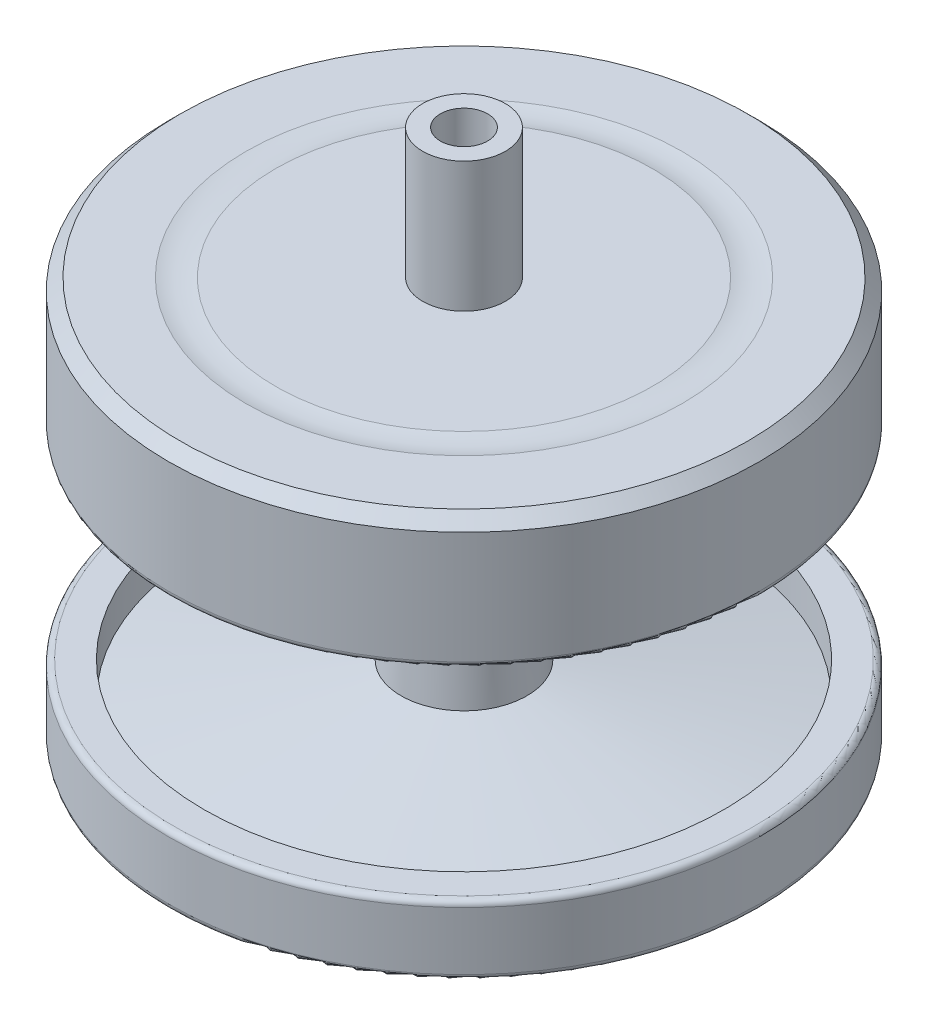
from build123d import *

# Parameters (mm, degrees)
FILLET_1_R = 0.5


with BuildPart() as part:
    # 草图1 → 旋转1 (revolve)
    with BuildSketch(Plane.XY, mode=Mode.PRIVATE) as revolve_1_sk:
        with BuildLine():
            Line((2, 0), (2, -27))
            Line((2, -27), (3.5, -27))
            Line((3.5, -27), (3.5, -42))
            ThreePointArc((3.5, -42), (4.378679656, -44.121320344), (6.5, -45))
            Line((6.5, -45), (25, -45))
            Line((25, -45), (25, -39))
            Line((25, -39), (22, -39))
            Line((22, -39), (22, -42))
            Line((22, -42), (5.322960875, -39))
            Line((5.322960875, -39), (3.5, -14))
            Line((3.5, -14), (22, -14))
            Line((22, -14), (22, -22))
            Line((22, -22), (25, -22))
            Line((25, -22), (25, -11))
            Line((25, -11), (3.5, -11))
            Line((3.5, -11), (3.5, 0))
            Line((3.5, 0), (2, 0))
        make_face()
    revolve(revolve_1_sk.sketch.rotate(Axis((0, 0, 0), (0, -1, 0)), 90), axis=Axis((0, 0, 0), (0, -1, 0)))

    # 草图2 → 切除-旋转1 (revolve, cut)
    with BuildSketch(Plane.XY, mode=Mode.PRIVATE) as cut_revolve_1_sk:
        Polygon((24, -11), (25, -11), (25, -12), align=None)
        with BuildLine():
            Line((15.957718437, -11), (18.473529007, -11))
            ThreePointArc((18.473529007, -11), (17.215623722, -11.145738564), (15.957718437, -11))
        make_face()
        with BuildLine():
            Line((0, -43), (0, -45))
            Line((0, -45), (25, -45))
            ThreePointArc((25, -45), (12.539936204, -43.50079745), (0, -43))
        make_face()
    revolve(cut_revolve_1_sk.sketch.rotate(Axis((0, 0, 0), (0, -1, 0)), 180), axis=Axis((0, 0, 0), (0, -1, 0)), mode=Mode.SUBTRACT)

    # 圆角1
    fillet_1_edges = [part.edges().sort_by_distance(p)[0] for p in [
        (0, -39, -25),
        (0, -22, -25),
        (17.67766953, -45, -17.67766953),
    ]]
    fillet(fillet_1_edges, radius=FILLET_1_R)


solid = part.part
